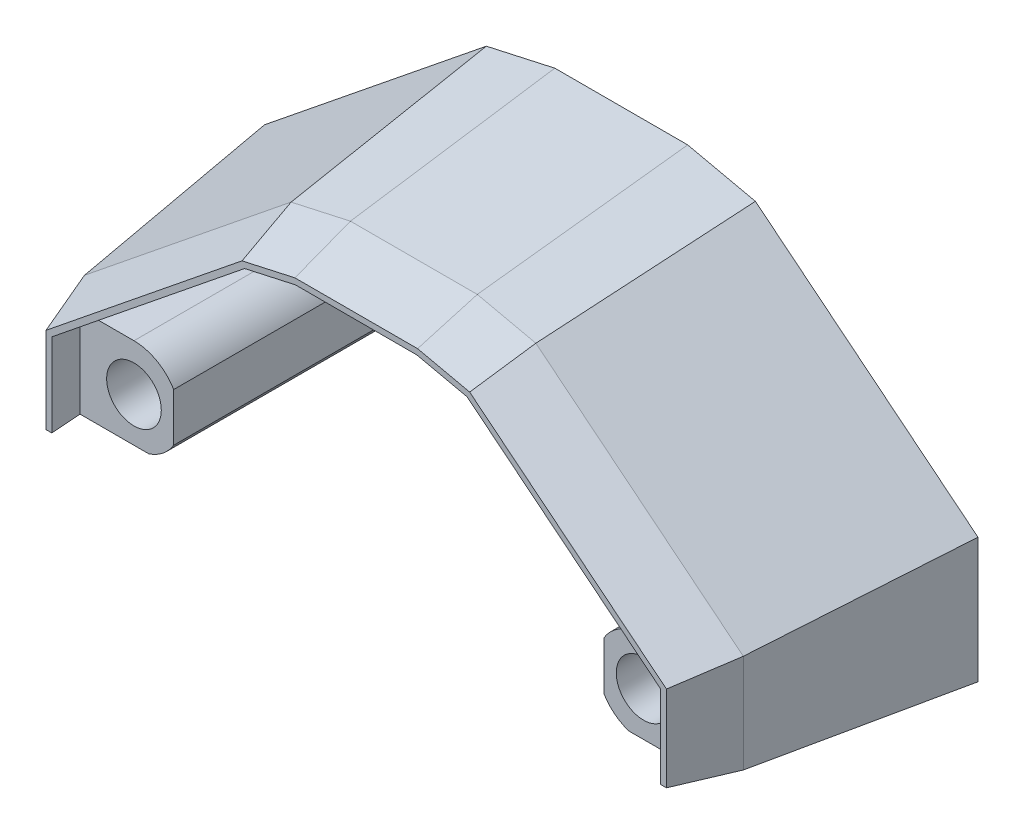
from build123d import *

# Parameters (mm, degrees)
CHANFREIN1_SIZE              = 1
CHANFREIN1_SIZE2             = 5
BOSS_EXTRU_5_DEPTH           = 20
BOSS_EXTRU_5_2_DEPTH         = 20
ENL_V_MAT_EXTRU_2_DEPTH      = 62.559283201
ENL_V_MAT_EXTRU_2_DEPTH_BACK = 62.559283201
BOSS_EXTRU_6_REACH           = 63.559
BOSS_EXTRU_7_REACH           = 63.559
ENL_V_MAT_EXTRU_3_DEPTH      = 45.313661961
ENL_V_MAT_EXTRU_3_DEPTH_BACK = 45.313661961
ENL_V_MAT_EXTRU_4_DEPTH      = 45.313661961
ENL_V_MAT_EXTRU_4_DEPTH_BACK = 4
ESQUISSE16_R                 = 2.35
ENL_V_START                  = -4
ESQUISSE17_R                 = 2.35
ENL_V_MAT_EXTRU_5_DEPTH      = 4


with BuildPart() as part:
    # Esquisse2 → Lissage2 section 0
    with BuildSketch(Plane(origin=(0, 0, 22.8), x_dir=(-1, 0, 0), z_dir=(0, 0, -1))):
        with BuildLine():
            Line((9.60314516, 16.936366798), (5.221189916, 17.907863235))
            Line((5.221189916, 17.907863235), (-5.221189909, 17.907863235))
            Line((-5.221189909, 17.907863235), (-9.535571585, 16.951348119))
            Line((-9.535571585, 16.951348119), (-26.187917597, 3.514391472))
            Line((-26.187917597, 3.514391472), (-26.187917597, -3.605517616))
            Line((-26.187917597, -3.605517616), (-27.687917597, -3.605517616))
            Line((-27.687917597, -3.605517616), (-27.687917597, 4.231455295))
            Line((-27.687917597, 4.231455295), (-10.203724477, 18.339638298))
            Line((-10.203724477, 18.339638298), (-5.385473287, 19.407863235))
            Line((-5.385473287, 19.407863235), (5.385473294, 19.407863235))
            Line((5.385473294, 19.407863235), (10.271298051, 18.324656976))
            Line((10.271298051, 18.324656976), (27.687917597, 4.270999817))
            Line((27.687917597, 4.270999817), (27.687917597, -3.605517616))
            Line((27.687917597, -3.605517616), (26.187917597, -3.605517616))
            Line((26.187917597, -3.605517616), (26.187917597, 3.553935994))
            Line((26.187917597, 3.553935994), (9.60314516, 16.936366798))
        make_face()
    # Esquisse7 → Lissage2 section 1
    with BuildSketch(Plane.XY):
        with BuildLine():
            Line((30.687917597, -5.105517616), (30.687917597, 5.66558294))
            Line((30.687917597, 5.66558294), (11.54003026, 21.116218655))
            Line((11.54003026, 21.116218655), (5.714040045, 22.407863235))
            Line((5.714040045, 22.407863235), (-5.714040052, 22.407863235))
            Line((-5.714040052, 22.407863235), (-11.607603834, 21.101237334))
            Line((-11.607603834, 21.101237334), (-30.687917597, 5.705127462))
            Line((-30.687917597, 5.705127462), (-30.687917597, -5.105517616))
            Line((-30.687917597, -5.105517616), (-29.187917597, -5.105517616))
            Line((-29.187917597, -5.105517616), (-29.187917597, 4.988063639))
            Line((-29.187917597, 4.988063639), (-10.939450943, 19.712947155))
            Line((-10.939450943, 19.712947155), (-5.549756673, 20.907863235))
            Line((-5.549756673, 20.907863235), (5.549756666, 20.907863235))
            Line((5.549756666, 20.907863235), (10.871877368, 19.727928476))
            Line((10.871877368, 19.727928476), (29.187917597, 4.948519118))
            Line((29.187917597, 4.948519118), (29.187917597, -5.105517616))
            Line((29.187917597, -5.105517616), (30.687917597, -5.105517616))
        make_face()
    loft()

    # Chanfrein1
    chanfrein1_edges = [part.edges().sort_by_distance(p)[0] for p in [
        (-27.687917597, 0.3327411, 22.8),
        (-18.979607824, 11.297828397, 22.8),
        (-7.828385673, 18.866260106, 22.8),
        (-4e-09, 19.407863235, 22.8),
        (7.794598882, 18.873750766, 22.8),
        (18.945821037, 11.285546796, 22.8),
        (27.687917597, 0.312968839, 22.8),
    ]]
    chanfrein1_side = [part.faces().sort_by_distance(p)[0] for p in [
        (-7.541966061, 18.007574003, 22.8),
    ]]
    chamfer(chanfrein1_edges, length=CHANFREIN1_SIZE, length2=CHANFREIN1_SIZE2, reference=chanfrein1_side[0])

    # Esquisse12 → Boss.-Extru.6 (add, up to next)
    with BuildSketch(Plane(origin=(21.92, 0, 0), x_dir=(0, 0, -1), z_dir=(1, 0, 0)), mode=Mode.PRIVATE) as boss_extru_6_sk1:
        Polygon((-16.803867762, -4), (-20, -3.789728142), (-20, 4), (0, 4), (0, -4), align=None)
    boss_extru_6_tool1 = extrude(boss_extru_6_sk1.sketch, amount=BOSS_EXTRU_6_REACH, mode=Mode.PRIVATE) - part.part


with BuildPart() as body_2:
    # Esquisse8 → Boss.-Extru.5 (new body)
    with BuildSketch(Plane(origin=(0, 0, 20), x_dir=(-1, 0, 0), z_dir=(0, 0, -1))):
        with BuildLine():
            Line((-21.92, 4), (-21.92, -4))
            ThreePointArc((-21.92, -4), (-17.92, 0), (-21.92, 4))
        make_face()
    extrude(amount=BOSS_EXTRU_5_DEPTH)


with BuildPart() as body_3:
    # Esquisse8 → Boss.-Extru.5 2 (new body)
    with BuildSketch(Plane(origin=(0, 0, 20), x_dir=(-1, 0, 0), z_dir=(0, 0, -1))):
        with BuildLine():
            Line((21.92, 4), (21.92, -4))
            ThreePointArc((21.92, -4), (17.92, 0), (21.92, 4))
        make_face()
    extrude(amount=BOSS_EXTRU_5_2_DEPTH)


with BuildPart() as enl_v_mat_extru_2_tool:
    # Esquisse11 → Enlèv. mat.-Extru.2 (new, two sides: drawn at the far end of the back side and taken through both)
    with BuildSketch(Plane(origin=(21.92, 0, 0), x_dir=(0, 0, -1), z_dir=(1, 0, 0)).offset(-ENL_V_MAT_EXTRU_2_DEPTH_BACK)):
        Polygon((-20, -3.789728142), (-16.803867762, -4), (-20, -4), align=None)
    extrude(amount=ENL_V_MAT_EXTRU_2_DEPTH + ENL_V_MAT_EXTRU_2_DEPTH_BACK)


with BuildPart() as body_2_1:
    add(body_2.part)

    # Enlèv. mat.-Extru.2: cut by enl_v_mat_extru_2_tool
    add(enl_v_mat_extru_2_tool.part, mode=Mode.SUBTRACT)


with BuildPart() as body_3_1:
    add(body_3.part)

    # Enlèv. mat.-Extru.2: cut by enl_v_mat_extru_2_tool
    add(enl_v_mat_extru_2_tool.part, mode=Mode.SUBTRACT)


with BuildPart() as part_1:
    add(part.part)

    add(body_2_1.part)  # Boss.-Extru.6 merges body 2
    add(boss_extru_6_tool1.solids().sort_by_distance((21.92, 0.008271, 9.981196))[0])

    # Esquisse14 → Boss.-Extru.7 (add, up to next)
    with BuildSketch(Plane.ZY.offset(21.92), mode=Mode.PRIVATE) as boss_extru_7_sk1:
        Polygon((0, 4), (20, 4), (20, -3.789728142), (16.803867762, -4), (0, -4), align=None)
    boss_extru_7_tool1 = extrude(boss_extru_7_sk1.sketch, amount=BOSS_EXTRU_7_REACH, mode=Mode.PRIVATE) - part_1.part

    add(body_3_1.part)  # Boss.-Extru.7 merges body 3
    add(boss_extru_7_tool1.solids().sort_by_distance((-21.92, 0.008271, 9.981196))[0])

    # Esquisse15 → Enlèv. mat.-Extru.3 (cut, two sides: drawn at the far end of the back side and taken through both)
    with BuildSketch(Plane(origin=(0, 0, 0), x_dir=(-1, 0, 0), z_dir=(0, 0, -1)).offset(-ENL_V_MAT_EXTRU_3_DEPTH_BACK)):
        with BuildLine():
            ThreePointArc((-18.5, -2.074511991), (-17.92, 0), (-18.5, 2.074511991))
            Line((-18.5, 2.074511991), (-18.5, -2.074511991))
        make_face()
        with BuildLine():
            Line((18.5, -2.074511991), (18.5, 2.074511991))
            ThreePointArc((18.5, 2.074511991), (17.92, 0), (18.5, -2.074511991))
        make_face()
        with BuildLine():
            Line((18.5, 2.074511991), (18.5, 3.295393564))
            ThreePointArc((18.5, 3.295393564), (17.170682287, 0), (18.5, -3.295393564))
            Line((18.5, -3.295393564), (18.5, -2.074511991))
            ThreePointArc((18.5, -2.074511991), (17.92, 0), (18.5, 2.074511991))
        make_face()
    extrude(amount=ENL_V_MAT_EXTRU_3_DEPTH + ENL_V_MAT_EXTRU_3_DEPTH_BACK, mode=Mode.SUBTRACT)

    # Esquisse16 → Enlèv. mat.-Extru.4 (cut, two sides: drawn at the far end of the back side and taken through both)
    with BuildSketch(Plane(origin=(0, 0, 0), x_dir=(-1, 0, 0), z_dir=(0, 0, -1)).offset(-ENL_V_MAT_EXTRU_4_DEPTH_BACK)):
        with Locations(Location((-21.92, 0, 0), (0, 0, 180))):
            Circle(ESQUISSE16_R)
        with Locations(Location((21.92, 0, 0), (0, 0, 180))):
            Circle(ESQUISSE16_R)
    extrude(amount=ENL_V_MAT_EXTRU_4_DEPTH + ENL_V_MAT_EXTRU_4_DEPTH_BACK, mode=Mode.SUBTRACT)

    # Esquisse17 → Enlèv. mat.-Extru.5 (cut)
    with BuildSketch(Plane.XY.offset(20).offset(ENL_V_START)):
        with Locations((-21.92, 0)):
            Circle(ESQUISSE17_R)
        with Locations((21.92, 0)):
            Circle(ESQUISSE17_R)
    extrude(amount=ENL_V_MAT_EXTRU_5_DEPTH, mode=Mode.SUBTRACT)


solid = part_1.part
